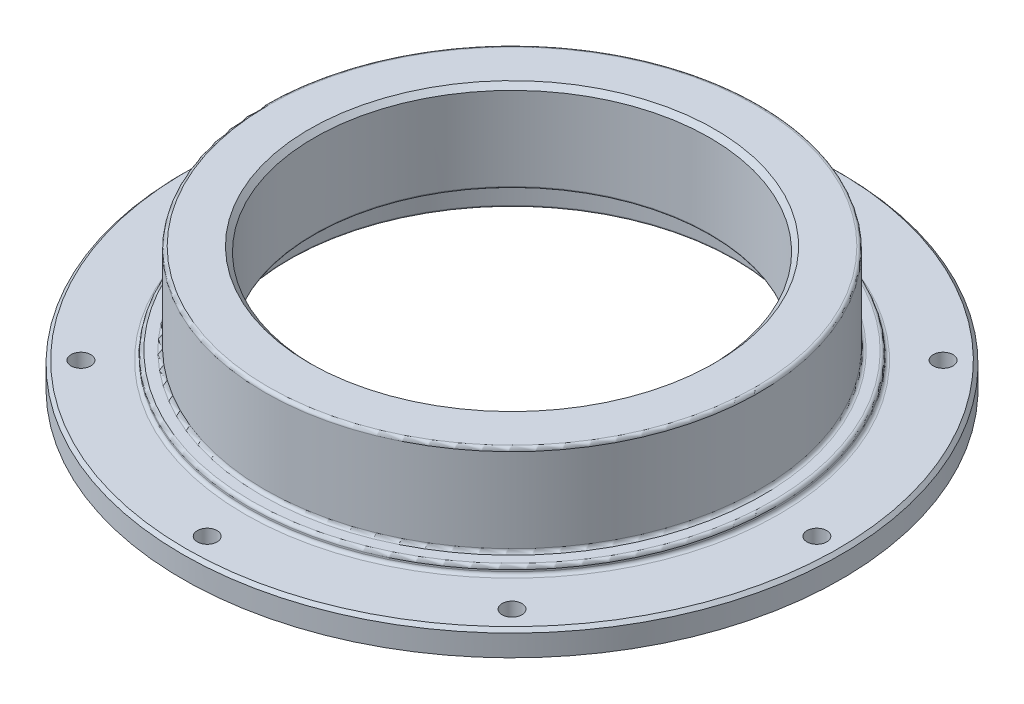
from build123d import *

# Parameters (mm, degrees)
SKETCH2_R          = 6
CUT_EXTRUDE1_DEPTH = 290.136645896
CIRPATTERN1_COUNT  = 8
CHAMFER2_SIZE      = 3
FILLET1_R          = 2
CHAMFER3_SIZE      = 2
FILLET2_R          = 1


with BuildPart() as part:
    # Sketch1 → Revolve1 (revolve)
    with BuildSketch(Plane.XY):
        Polygon((135, 0), (200, 0), (200, 15), (160, 15), (160, 20), (150, 20), (150, 75), (120, 75), (120, 20.5), (135, 20.5), align=None)
    revolve(axis=Axis((0, 0, 0), (0, 1, 0)))

    # Sketch2 → Cut-Extrude1 (cut, through all)
    with BuildSketch(Plane(origin=(0, 15, 0), x_dir=(1, 0, 0), z_dir=(0, 1, 0))):
        with Locations((0, 185)):
            Circle(SKETCH2_R)
    cut_extrude1 = extrude(amount=-CUT_EXTRUDE1_DEPTH, mode=Mode.SUBTRACT)

    # CirPattern1: Cut-Extrude1 ×8 about axis
    cirpattern1_axis = Axis((0, 75, 0), (0, -1, 0))
    for i in range(1, CIRPATTERN1_COUNT):
        add(cut_extrude1.rotate(cirpattern1_axis, i * 360 / CIRPATTERN1_COUNT), mode=Mode.SUBTRACT)

    # Chamfer2
    chamfer2_edges = [part.edges().sort_by_distance(p)[0] for p in [
        (-120, 75, 0),
    ]]
    chamfer(chamfer2_edges, length=CHAMFER2_SIZE)

    # Fillet1
    fillet1_edges = [part.edges().sort_by_distance(p)[0] for p in [
        (-160, 20, 0),
        (-160, 15, 0),
        (-150, 20, 0),
        (-150, 75, 0),
    ]]
    fillet(fillet1_edges, radius=FILLET1_R)

    # Chamfer3
    chamfer3_edges = [part.edges().sort_by_distance(p)[0] for p in [
        (-200, 15, 0),
    ]]
    chamfer(chamfer3_edges, length=CHAMFER3_SIZE)

    # Fillet2
    fillet2_edges = [part.edges().sort_by_distance(p)[0] for p in [
        (-120, 20.5, 0),
        (-135, 0, 0),
        (-135, 20.5, 0),
    ]]
    fillet(fillet2_edges, radius=FILLET2_R)


solid = part.part
